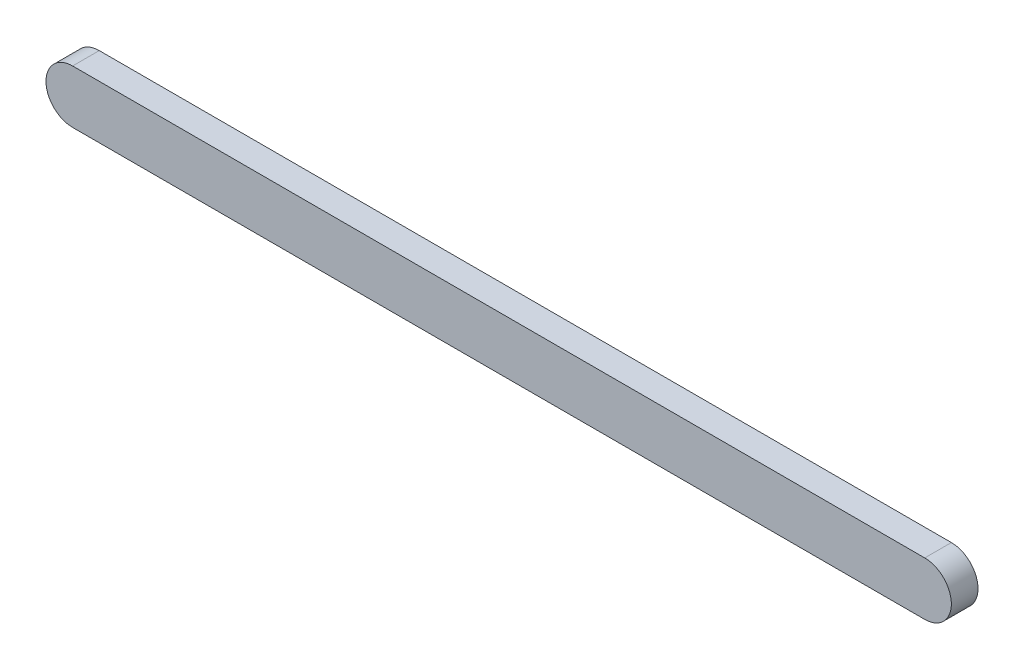
from build123d import *

# Parameters (mm, degrees)
BOSS_EXTRUDE1_DEPTH = 2.5


with BuildPart() as part:
    # Sketch3 → Boss-Extrude1 (new body)
    with BuildSketch(Plane.XY):
        with BuildLine():
            Line((0, 2.5), (80, 2.5))
            ThreePointArc((80, 2.5), (82.5, 0), (80, -2.5))
            Line((80, -2.5), (0, -2.5))
            ThreePointArc((0, -2.5), (-2.5, 0), (0, 2.5))
        make_face()
    extrude(amount=BOSS_EXTRUDE1_DEPTH)


solid = part.part
